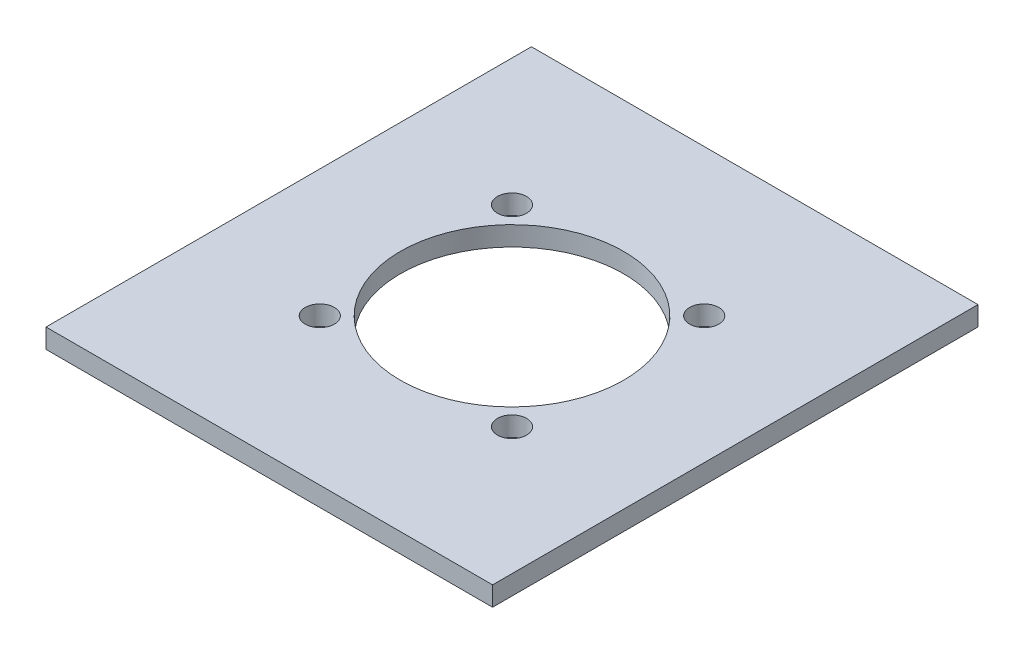
from build123d import *

# Parameters (mm, degrees)
SKETCH1_W           = 46
SKETCH1_H           = 50
BOSS_EXTRUDE1_DEPTH = 2
SKETCH2_R           = 11.5
CUT_EXTRUDE2_DEPTH  = 35.029399054
SKETCH3_R           = 1.5
CUT_EXTRUDE3_DEPTH  = 35.029399054


with BuildPart() as part:
    # Sketch1 → Boss-Extrude1 (new body)
    with BuildSketch(Plane(origin=(0, 0, 0), x_dir=(1, 0, 0), z_dir=(0, 1, 0))):
        Rectangle(SKETCH1_W, SKETCH1_H)
    extrude(amount=BOSS_EXTRUDE1_DEPTH)

    # Sketch2 → Cut-Extrude2 (cut, through all)
    with BuildSketch(Plane(origin=(0, 2, 0), x_dir=(1, 0, 0), z_dir=(0, 1, 0))):
        with Locations(Location((0, 0, 0), (0, 0, 270))):
            Circle(SKETCH2_R)
    extrude(amount=-CUT_EXTRUDE2_DEPTH, mode=Mode.SUBTRACT)

    # Sketch3 → Cut-Extrude3 (cut, through all)
    with BuildSketch(Plane(origin=(0, 2, 0), x_dir=(1, 0, 0), z_dir=(0, 1, 0))):
        with Locations(Location((9.899494937, 9.899494937, 0), (0, 0, 270))):
            Circle(SKETCH3_R)
        with Locations(Location((-9.899494937, 9.899494937, 0), (0, 0, 270))):
            Circle(SKETCH3_R)
        with Locations(Location((-9.899494937, -9.899494937, 0), (0, 0, 270))):
            Circle(SKETCH3_R)
        with Locations(Location((9.899494937, -9.899494937, 0), (0, 0, 270))):
            Circle(SKETCH3_R)
    extrude(amount=-CUT_EXTRUDE3_DEPTH, mode=Mode.SUBTRACT)


solid = part.part
